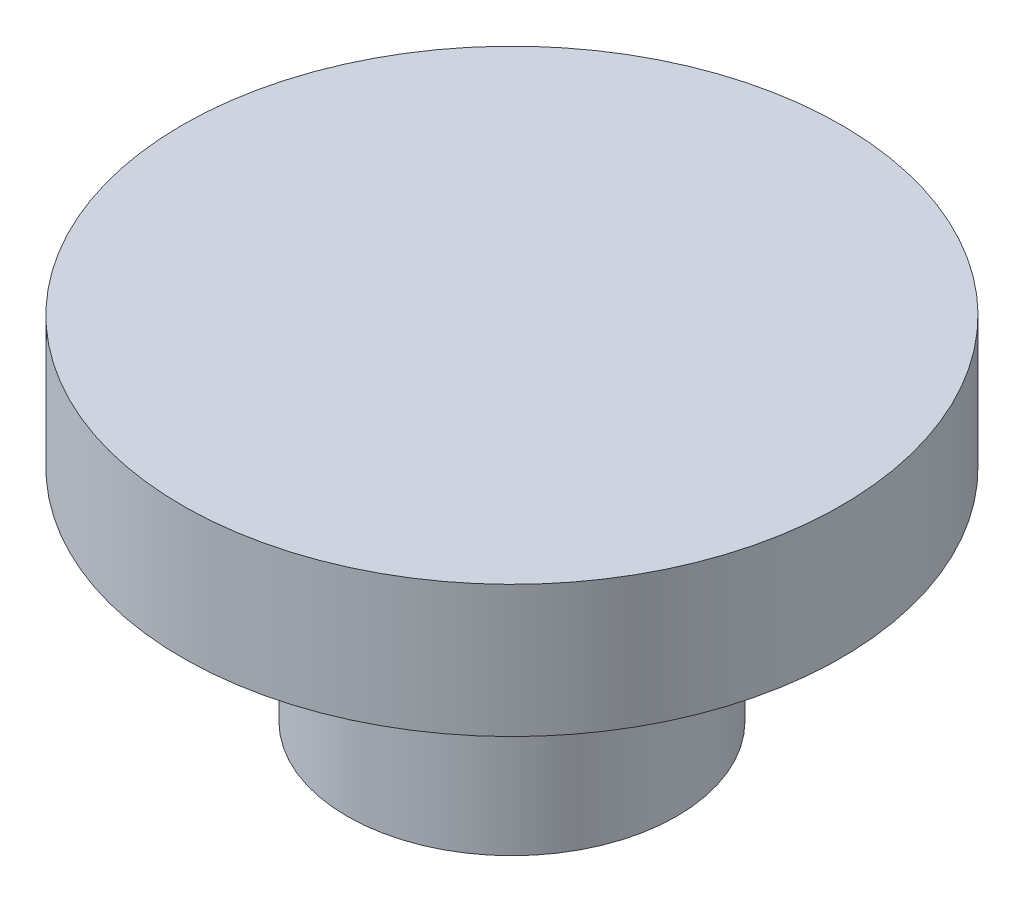
from build123d import *


with BuildPart() as part:
    # Sketch1 → Revolve1 (revolve)
    with BuildSketch(Plane.XY, mode=Mode.PRIVATE) as revolve1_sk:
        Polygon((0, 0), (7.5, 0), (7.5, 8), (4.5, 8), (4.5, 10), (15, 10), (15, 16), (0, 16), align=None)
    revolve(revolve1_sk.sketch.rotate(Axis((0, 16, 0), (0, -1, 0)), 180), axis=Axis((0, 16, 0), (0, -1, 0)))


solid = part.part
